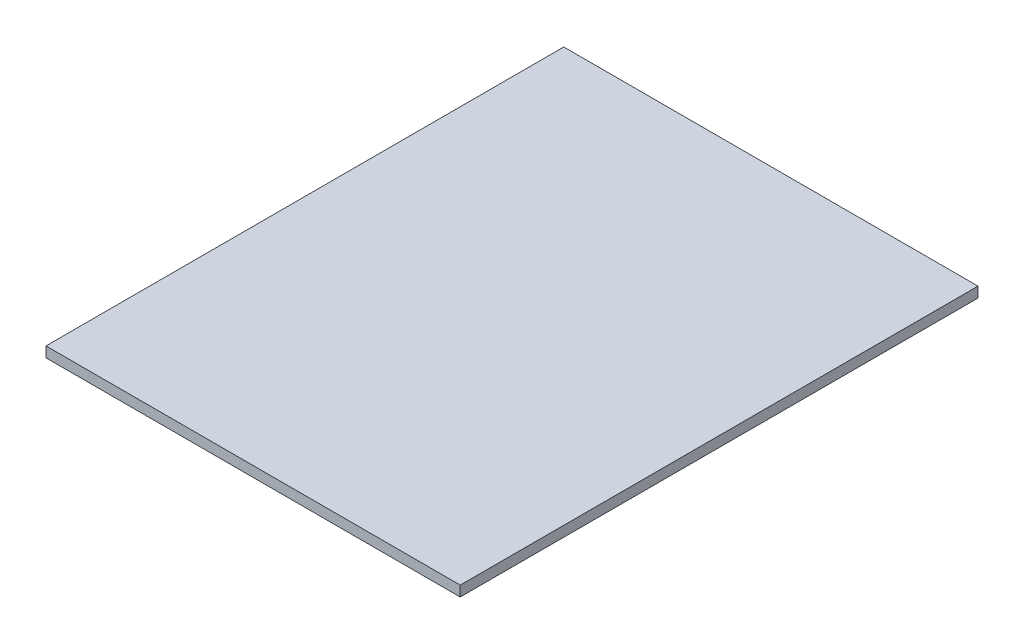
from build123d import *

# Parameters (mm, degrees)
SKETCH1_W           = 200
SKETCH1_H           = 250
BOSS_EXTRUDE1_DEPTH = 5


with BuildPart() as part:
    # Sketch1 → Boss-Extrude1 (new body)
    with BuildSketch(Plane(origin=(0, 0, 0), x_dir=(1, 0, 0), z_dir=(0, 1, 0))):
        Rectangle(SKETCH1_W, SKETCH1_H)
    extrude(amount=BOSS_EXTRUDE1_DEPTH)


solid = part.part
